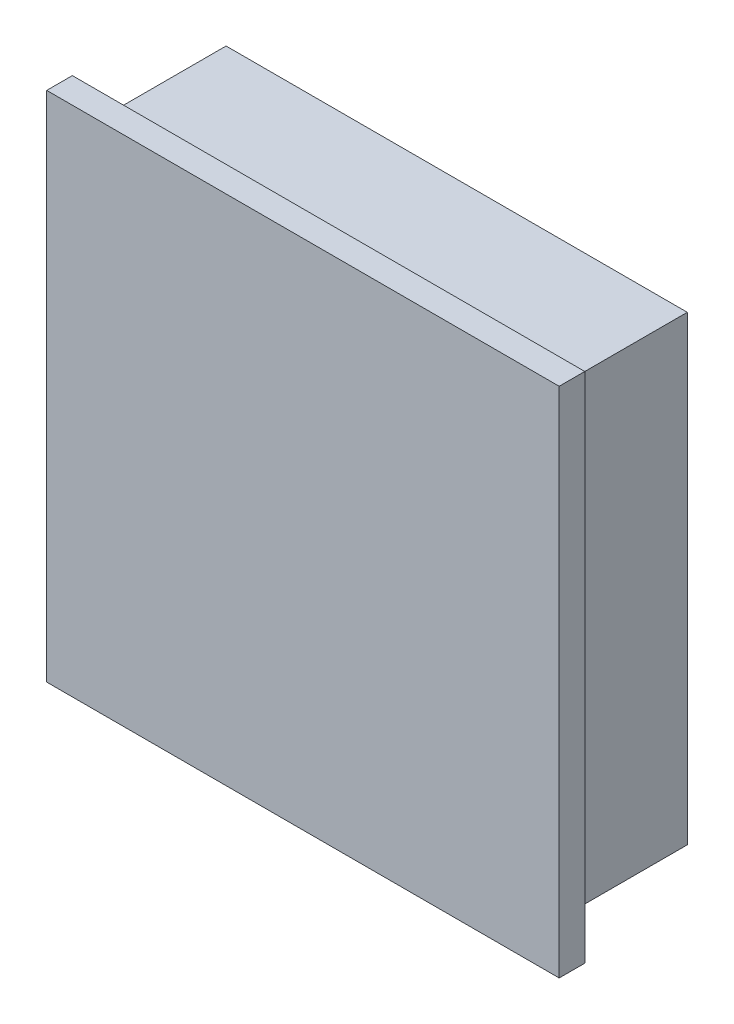
from build123d import *

# Parameters (mm, degrees)
SKETCH1_W           = 36
SKETCH1_H           = 36
BOSS_EXTRUDE1_DEPTH = 10
SKETCH2_W           = 40
SKETCH2_H           = 40
BOSS_EXTRUDE2_DEPTH = 2


with BuildPart() as part:
    # Sketch1 → Boss-Extrude1 (new body)
    with BuildSketch(Plane.XY):
        with Locations((18, 18)):
            Rectangle(SKETCH1_W, SKETCH1_H)
    extrude(amount=BOSS_EXTRUDE1_DEPTH)

    # Sketch2 → Boss-Extrude2 (add)
    with BuildSketch(Plane.XY.offset(10)):
        with Locations((18, 18)):
            Rectangle(SKETCH2_W, SKETCH2_H)
    extrude(amount=BOSS_EXTRUDE2_DEPTH)


solid = part.part
